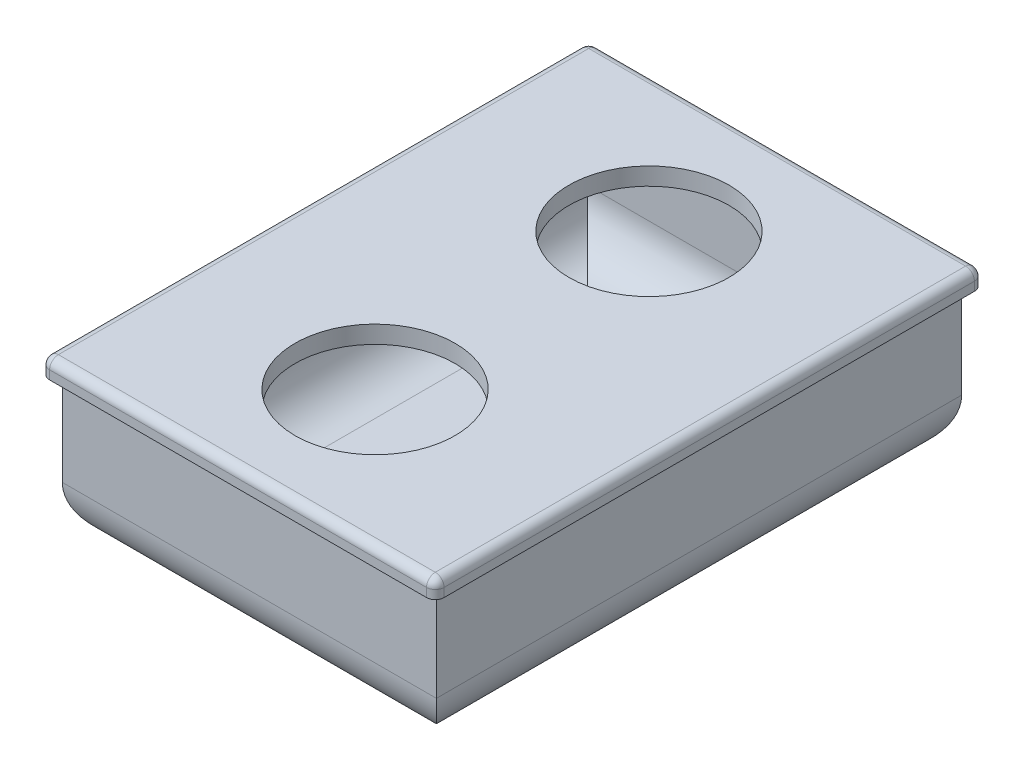
from build123d import *

# Parameters (mm, degrees)
SKETCH1_W           = 426.72
SKETCH1_H           = 599.186
BOSS_EXTRUDE1_DEPTH = 167.64
FILLET1_R           = 60.8
SHELL4_T            = -6.35
BOSS_EXTRUDE3_START = -167.64
SKETCH7_W           = 450
SKETCH7_H           = 625
BOSS_EXTRUDE3_DEPTH = 20
CUT_EXTRUDE4_START  = 167.64
SKETCH8_R           = 91.297613413
CUT_EXTRUDE4_DEPTH  = 20
FILLET4_R           = 10


with BuildPart() as part:
    # Sketch1 → Boss-Extrude1 (new body)
    with BuildSketch(Plane(origin=(0, 0, 0), x_dir=(1, 0, 0), z_dir=(0, 1, 0))):
        Rectangle(SKETCH1_W, SKETCH1_H)
    extrude(amount=BOSS_EXTRUDE1_DEPTH)

    # Fillet1
    fillet1_edges = [part.edges().sort_by_distance(p)[0] for p in [
        (0, 0, 299.593),
        (-213.36, 0, 0),
        (0, 0, -299.593),
        (213.36, 0, 0),
    ]]
    fillet(fillet1_edges, radius=FILLET1_R)

    # Shell4
    shell4_openings = [part.faces().sort_by_distance(p)[0] for p in [
        (0, 167.64, 0),
    ]]
    offset(amount=SHELL4_T, openings=shell4_openings)

    # Sketch7 → Boss-Extrude3 (add)
    with BuildSketch(Plane.XZ.offset(BOSS_EXTRUDE3_START)):
        Rectangle(SKETCH7_W, SKETCH7_H)
    extrude(amount=-BOSS_EXTRUDE3_DEPTH)

    # Sketch8 → Cut-Extrude4 (cut)
    with BuildSketch(Plane(origin=(0, 0, 0), x_dir=(1, 0, 0), z_dir=(0, 1, 0)).offset(CUT_EXTRUDE4_START)):
        with Locations(Location((0, -156.25, 0), (0, 0, 90))):
            Circle(SKETCH8_R)
        with Locations(Location((0, 156.25, 0), (0, 0, 90))):
            Circle(SKETCH8_R)
    extrude(amount=CUT_EXTRUDE4_DEPTH, mode=Mode.SUBTRACT)

    # Fillet4
    fillet4_edges = [part.edges().sort_by_distance(p)[0] for p in [
        (-225, 187.64, 0),
        (-225, 177.64, -312.5),
        (0, 187.64, 312.5),
        (-225, 177.64, 312.5),
        (225, 187.64, 0),
        (225, 177.64, 312.5),
        (0, 187.64, -312.5),
        (225, 177.64, -312.5),
    ]]
    fillet(fillet4_edges, radius=FILLET4_R)


solid = part.part
